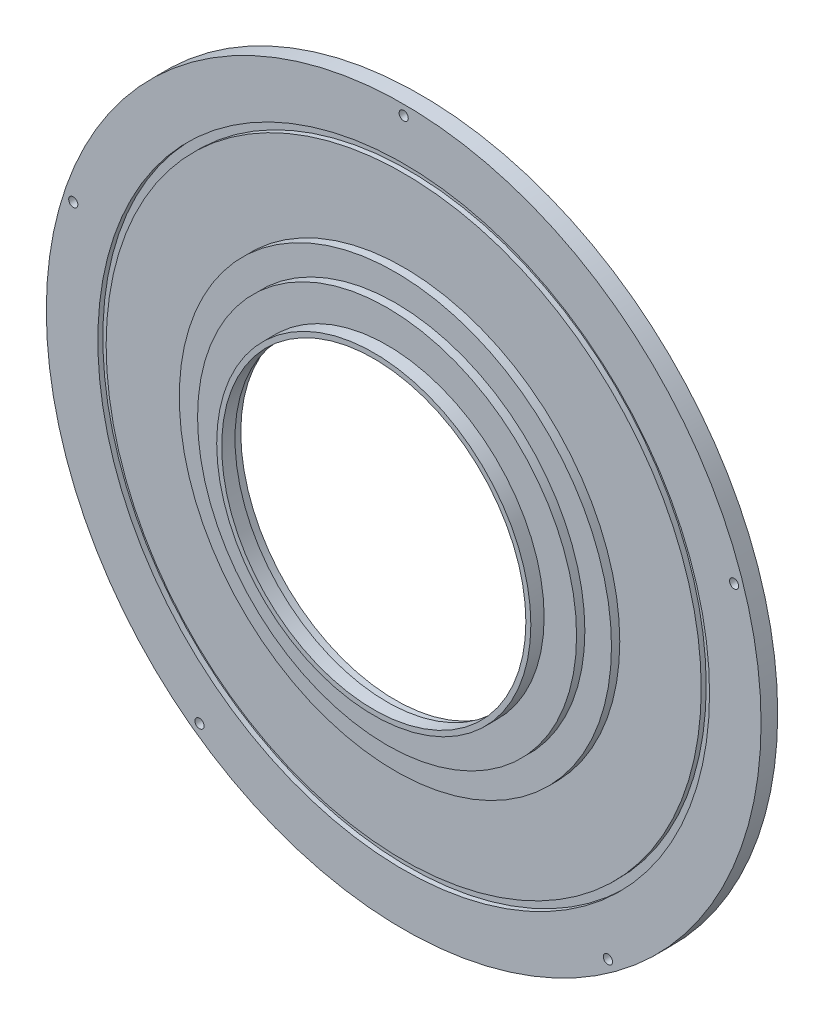
from build123d import *

# Parameters (mm, degrees)
SKETCH1_R         = 215
SKETCH1_R_2       = 120
PLATE_DEPTH       = 10
SKETCH2_R         = 130
SKETCH2_R_2       = 111
BELLMOUTH1_DEPTH  = 5
SKETCH3_R         = 114
SKETCH3_R_2       = 93
BELLMOUTH2_DEPTH  = 5
SKETCH4_R         = 94.5
SKETCH4_R_2       = 91.5
BELLMOUTH3_DEPTH  = 8
SKETCH5_R         = 204
SKETCH5_R_2       = 144
COMB_GROOVE_DEPTH = 4
SKETCH6_R         = 184
SKETCH6_R_2       = 179
BAND_SEAT_DEPTH   = 3
SKETCH7_R         = 2.75
ROD_HOLES_DEPTH   = 10


with BuildPart() as part:
    # Sketch1 → Plate (new body)
    with BuildSketch(Plane.XY):
        Circle(SKETCH1_R)
        Circle(SKETCH1_R_2, mode=Mode.SUBTRACT)
    extrude(amount=PLATE_DEPTH)

    # Sketch2 → Bellmouth1 (add)
    with BuildSketch(Plane.XY.offset(10)):
        Circle(SKETCH2_R)
        Circle(SKETCH2_R_2, mode=Mode.SUBTRACT)
    extrude(amount=BELLMOUTH1_DEPTH)

    # Sketch3 → Bellmouth2 (add)
    with BuildSketch(Plane.XY.offset(15)):
        Circle(SKETCH3_R)
        Circle(SKETCH3_R_2, mode=Mode.SUBTRACT)
    extrude(amount=BELLMOUTH2_DEPTH)

    # Sketch4 → Bellmouth3 (add)
    with BuildSketch(Plane.XY.offset(20)):
        Circle(SKETCH4_R)
        Circle(SKETCH4_R_2, mode=Mode.SUBTRACT)
    extrude(amount=BELLMOUTH3_DEPTH)

    # Sketch5 → Comb_groove (cut)
    with BuildSketch(Plane.XY):
        Circle(SKETCH5_R)
        Circle(SKETCH5_R_2, mode=Mode.SUBTRACT)
    extrude(amount=COMB_GROOVE_DEPTH, mode=Mode.SUBTRACT)

    # Sketch6 → Band_seat (cut)
    with BuildSketch(Plane.XY.offset(7)):
        Circle(SKETCH6_R)
        Circle(SKETCH6_R_2, mode=Mode.SUBTRACT)
    extrude(amount=BAND_SEAT_DEPTH, mode=Mode.SUBTRACT)

    # Sketch7 → Rod_holes (cut)
    with BuildSketch(Plane.XY):
        with Locations((198.770811906, 64.584551824)):
            Circle(SKETCH7_R)
        with Locations((0, 209)):
            Circle(SKETCH7_R)
        with Locations((-198.770811906, 64.584551824)):
            Circle(SKETCH7_R)
        with Locations((-122.847117729, -169.084551824)):
            Circle(SKETCH7_R)
        with Locations((122.847117729, -169.084551824)):
            Circle(SKETCH7_R)
    extrude(amount=ROD_HOLES_DEPTH, mode=Mode.SUBTRACT)


solid = part.part
